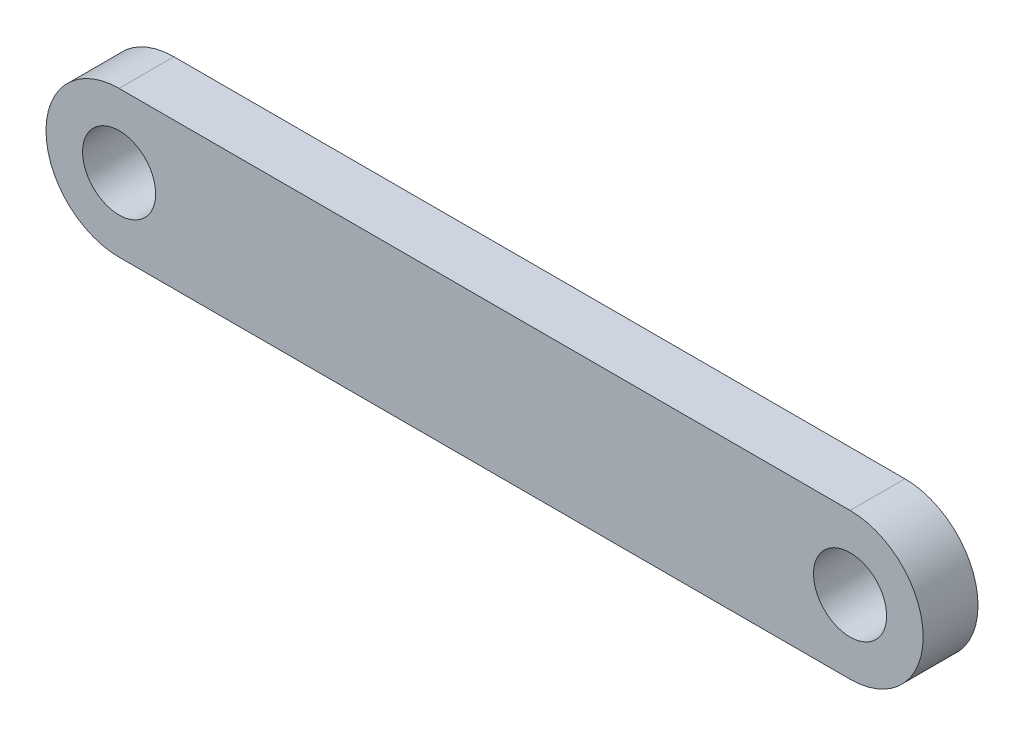
from build123d import *

# Parameters (mm, degrees)
SKETCH1_R           = 2.54
BOSS_EXTRUDE1_DEPTH = 3.81


with BuildPart() as part:
    # Sketch1 → Boss-Extrude1 (new body)
    with BuildSketch(Plane.XY):
        with BuildLine():
            Line((-25.4, 5.08), (25.4, 5.08))
            ThreePointArc((25.4, 5.08), (30.48, 0), (25.4, -5.08))
            Line((25.4, -5.08), (-25.4, -5.08))
            ThreePointArc((-25.4, -5.08), (-30.48, 0), (-25.4, 5.08))
        make_face()
        with Locations(Location((-25.4, 0, 0), (0, 0, 180))):
            Circle(SKETCH1_R, mode=Mode.SUBTRACT)
        with Locations(Location((25.4, 0, 0), (0, 0, 180))):
            Circle(SKETCH1_R, mode=Mode.SUBTRACT)
    extrude(amount=BOSS_EXTRUDE1_DEPTH)


solid = part.part
